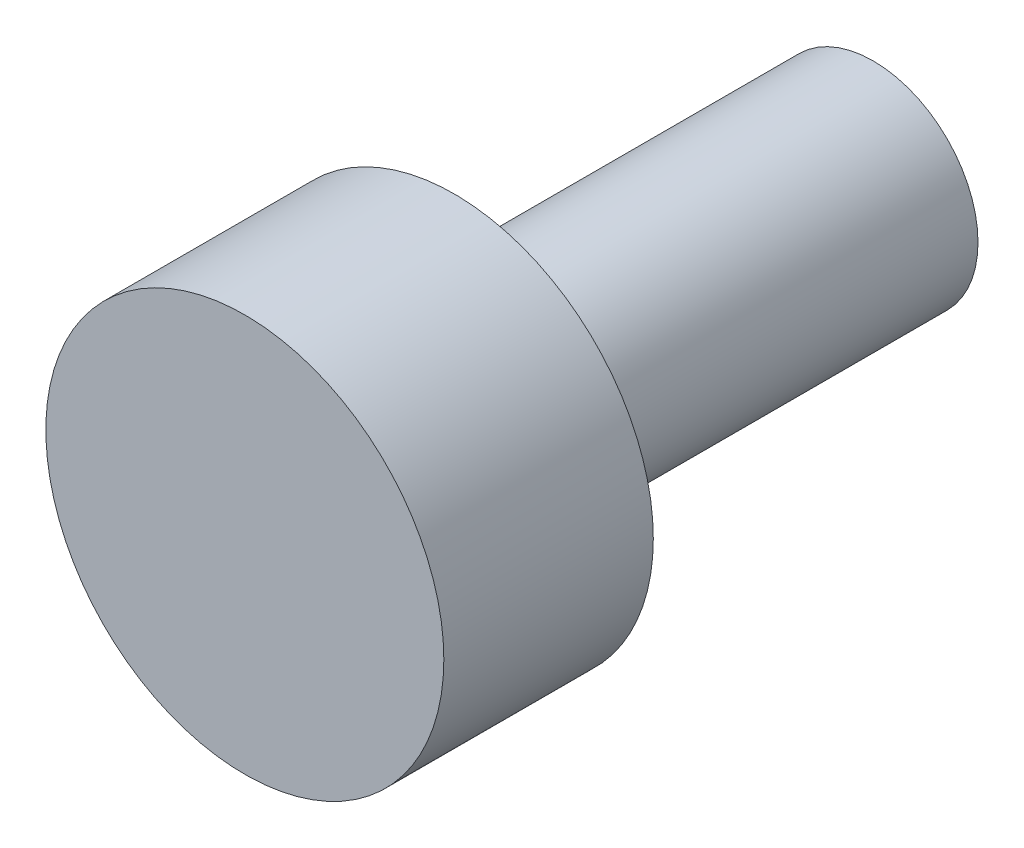
from build123d import *

# Parameters (mm, degrees)
SKETCH1_R           = 1.5
BOSS_EXTRUDE1_DEPTH = 6
SKETCH2_R           = 2.85
BOSS_EXTRUDE2_DEPTH = 3


with BuildPart() as part:
    # Sketch1 → Boss-Extrude1 (new body)
    with BuildSketch(Plane.XY):
        Circle(SKETCH1_R)
    extrude(amount=BOSS_EXTRUDE1_DEPTH)

    # Sketch2 → Boss-Extrude2 (add)
    with BuildSketch(Plane.XY.offset(6)):
        Circle(SKETCH2_R)
    extrude(amount=BOSS_EXTRUDE2_DEPTH)


solid = part.part
